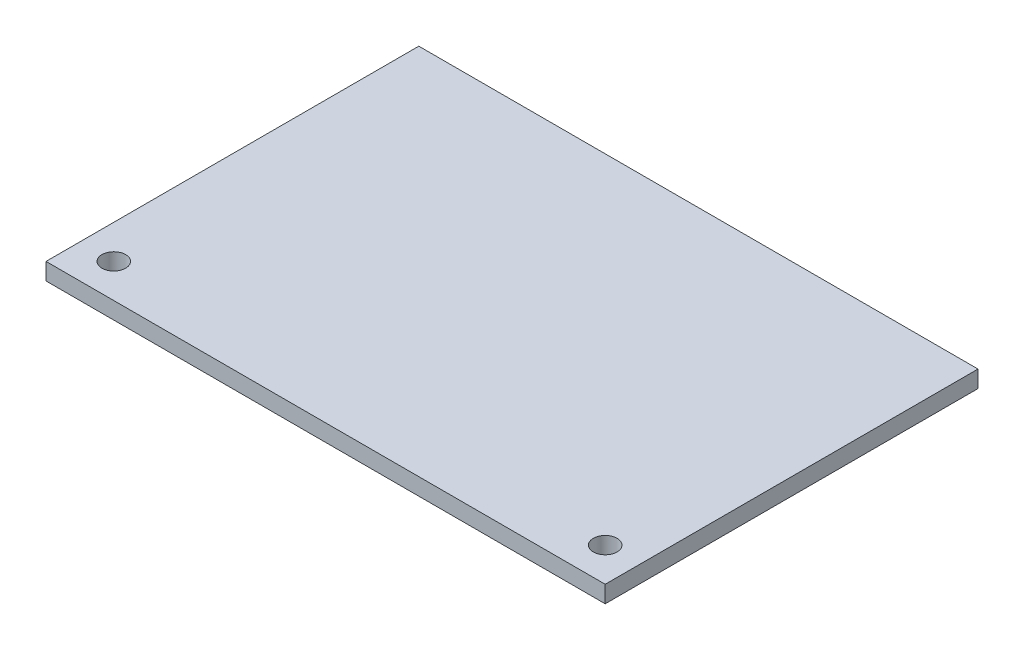
from build123d import *

# Parameters (mm, degrees)
SKETCH1_W           = 165
SKETCH1_H           = 110
SKETCH1_R           = 3.5
BOSS_EXTRUDE1_DEPTH = 5


with BuildPart() as part:
    # Sketch1 → Boss-Extrude1 (new body)
    with BuildSketch(Plane(origin=(0, 0, 0), x_dir=(1, 0, 0), z_dir=(0, 1, 0))):
        Rectangle(SKETCH1_W, SKETCH1_H)
        with Locations(Location((72.5, -45, 0), (0, 0, 270))):
            Circle(SKETCH1_R, mode=Mode.SUBTRACT)
        with Locations(Location((-72.5, -45, 0), (0, 0, 270))):
            Circle(SKETCH1_R, mode=Mode.SUBTRACT)
    extrude(amount=BOSS_EXTRUDE1_DEPTH)


solid = part.part
